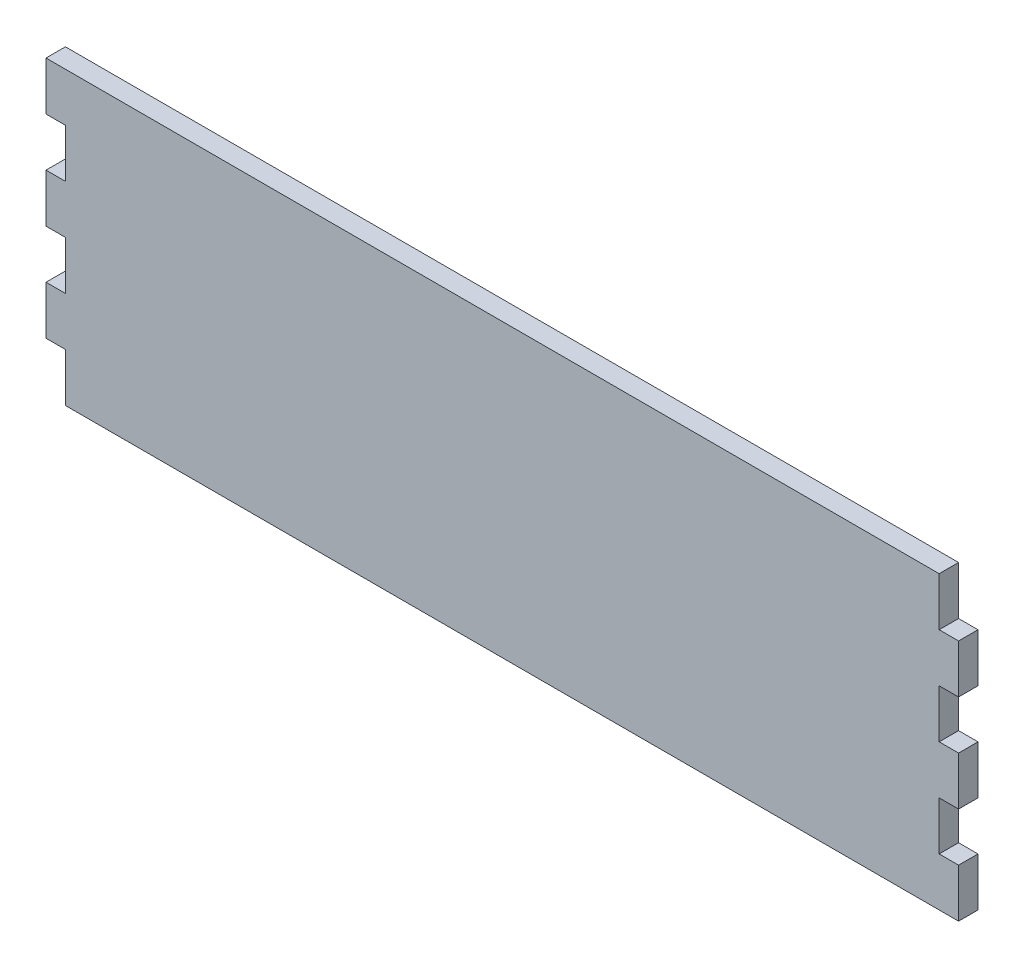
from build123d import *

# Parameters (mm, degrees)
EXTRUDE_1_DEPTH = 5


with BuildPart() as part:
    # Эскиз1 → Бобышка-Вытянуть1 (new body)
    with BuildSketch(Plane.XY):
        Polygon((0, 0), (0, 12.5), (-5, 12.5), (-5, 25), (0, 25), (0, 37.5), (-5, 37.5), (-5, 50), (0, 50), (0, 62.5), (-5, 62.5), (-5, 75), (225, 75), (225, 62.5), (230, 62.5), (230, 50), (225, 50), (225, 37.5), (230, 37.5), (230, 25), (225, 25), (225, 12.5), (230, 12.5), (230, 0), align=None)
    extrude(amount=EXTRUDE_1_DEPTH)


solid = part.part
